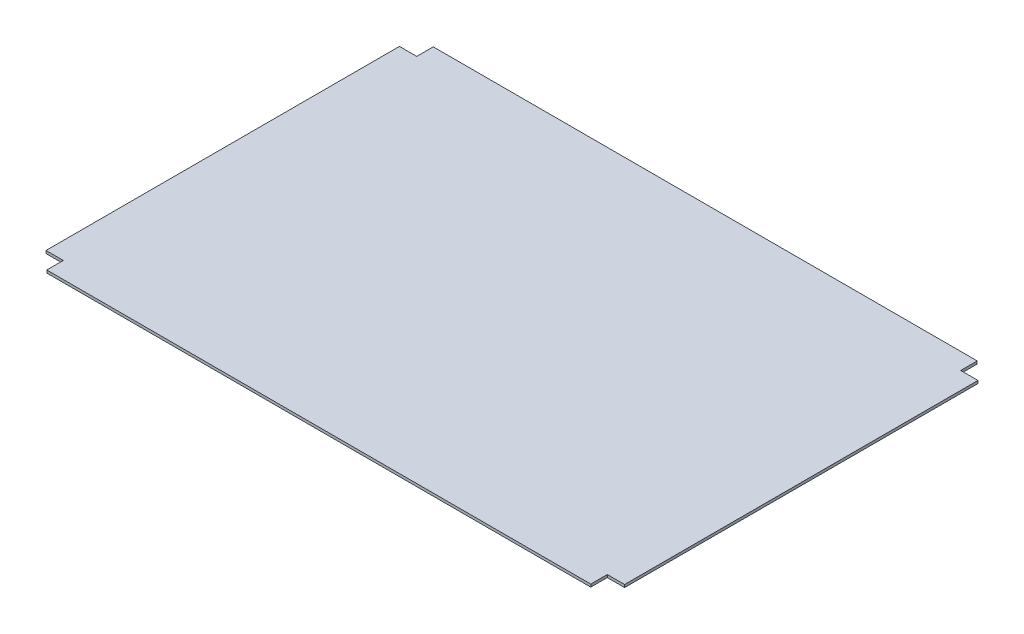
from build123d import *

# Parameters (mm, degrees)
CROQUIS1_W              = 1506
CROQUIS1_H              = 1006
SALIENTE_EXTRUIR1_DEPTH = 7
CROQUIS2_W              = 45
CROQUIS2_H              = 43
CORTAR_EXTRUIR1_DEPTH   = 10


with BuildPart() as part:
    # Croquis1 → Saliente-Extruir1 (new body)
    with BuildSketch(Plane(origin=(0, 0, 0), x_dir=(1, 0, 0), z_dir=(0, 1, 0))):
        Rectangle(CROQUIS1_W, CROQUIS1_H)
    extrude(amount=SALIENTE_EXTRUIR1_DEPTH)

    # Croquis2 → Cortar-Extruir1 (cut)
    with BuildSketch(Plane(origin=(0, 7, 0), x_dir=(1, 0, 0), z_dir=(0, 1, 0))):
        with Locations((-730.5, 481.5)):
            Rectangle(CROQUIS2_W, CROQUIS2_H)
        with Locations((-730.5, -481.5)):
            Rectangle(CROQUIS2_W, CROQUIS2_H)
        with Locations((730.5, -481.5)):
            Rectangle(CROQUIS2_W, CROQUIS2_H)
        with Locations((730.5, 481.5)):
            Rectangle(CROQUIS2_W, CROQUIS2_H)
    extrude(amount=-CORTAR_EXTRUIR1_DEPTH, mode=Mode.SUBTRACT)


solid = part.part
